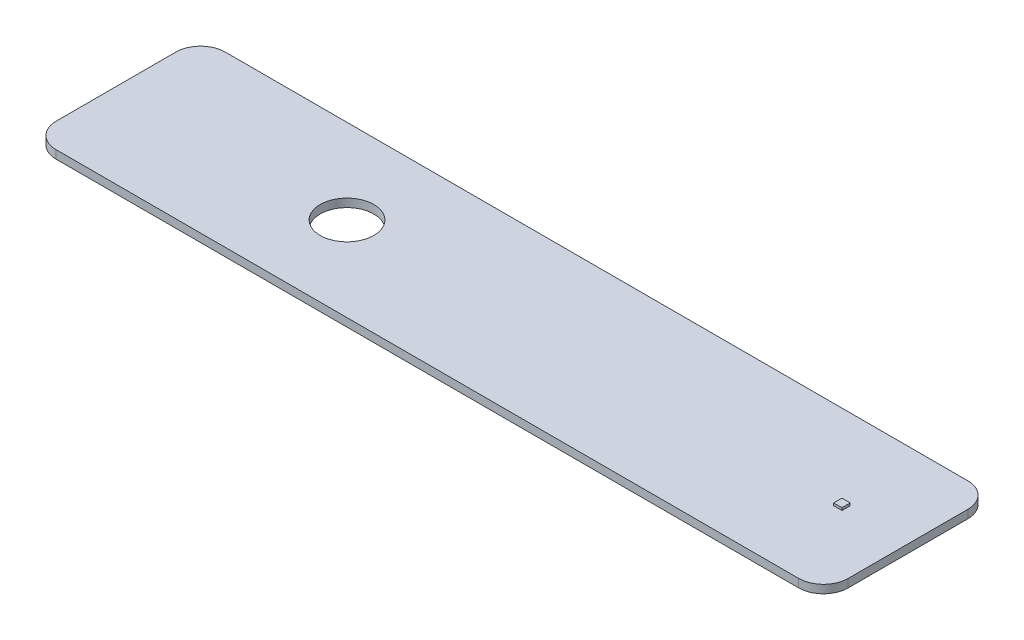
from build123d import *

# Parameters (mm, degrees)
BOSS_EXTRUDE1_DEPTH = 1
SKETCH2_W           = 1
SKETCH2_H           = 1
BOSS_EXTRUDE2_DEPTH = 0.3
SKETCH3_R           = 3.25
CUT_EXTRUDE1_DEPTH  = 50.092387394


with BuildPart() as part:
    # Sketch1 → Boss-Extrude1 (new body)
    with BuildSketch(Plane(origin=(0, 0, 0), x_dir=(1, 0, 0), z_dir=(0, 1, 0))):
        with BuildLine():
            Line((-45, 10.25), (45, 10.25))
            ThreePointArc((45, 10.25), (47.121320344, 9.371320344), (48, 7.25))
            Line((48, 7.25), (48, -7.25))
            ThreePointArc((48, -7.25), (47.121320344, -9.371320344), (45, -10.25))
            Line((45, -10.25), (-45, -10.25))
            ThreePointArc((-45, -10.25), (-47.121320344, -9.371320344), (-48, -7.25))
            Line((-48, -7.25), (-48, 7.25))
            ThreePointArc((-48, 7.25), (-47.121320344, 9.371320344), (-45, 10.25))
        make_face()
    extrude(amount=BOSS_EXTRUDE1_DEPTH)

    # Sketch2 → Boss-Extrude2 (add)
    with BuildSketch(Plane(origin=(0, 1, 0), x_dir=(1, 0, 0), z_dir=(0, 1, 0))):
        with Locations((40, 0)):
            Rectangle(SKETCH2_W, SKETCH2_H)
    extrude(amount=BOSS_EXTRUDE2_DEPTH)

    # Sketch3 → Cut-Extrude1 (cut, through all)
    with BuildSketch(Plane(origin=(0, 1, 0), x_dir=(1, 0, 0), z_dir=(0, 1, 0))):
        with Locations(Location((-20, 0, 0), (0, 0, 270))):
            Circle(SKETCH3_R)
    extrude(amount=-CUT_EXTRUDE1_DEPTH, mode=Mode.SUBTRACT)


solid = part.part
